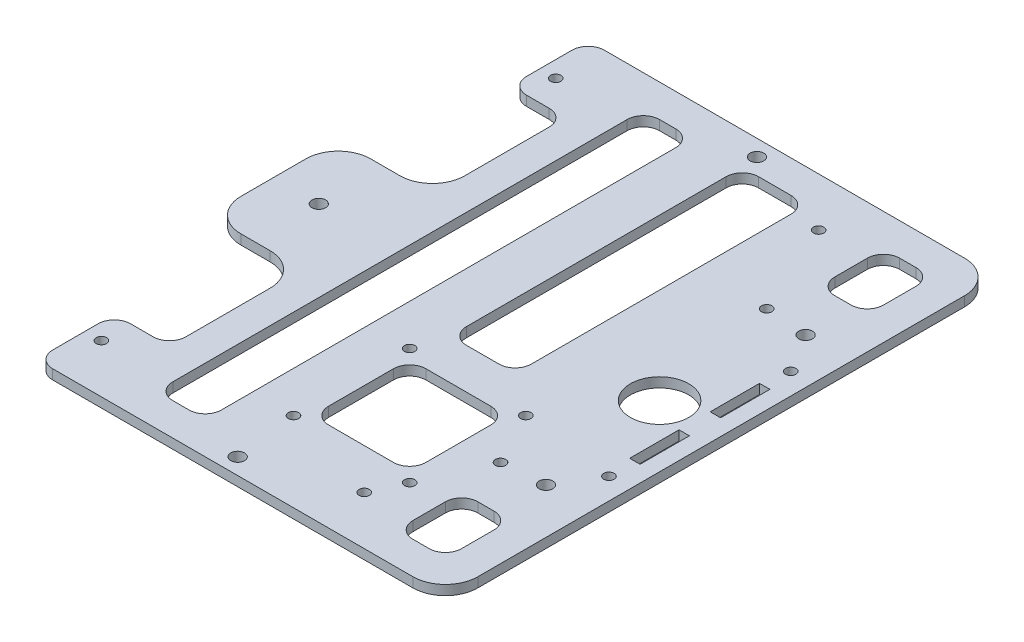
from build123d import *

# Parameters (mm, degrees)
SKETCH1_W           = 138
SKETCH1_H           = 170
BOSS_EXTRUDE1_DEPTH = 3
SKETCH2_R           = 2.1
SKETCH2_W           = 29
SKETCH2_H           = 30
CUT_EXTRUDE1_DEPTH  = 3
SKETCH3_R           = 2.1
CUT_EXTRUDE2_DEPTH  = 219.981734398
SKETCH5_W           = 29
SKETCH5_H           = 35
CUT_EXTRUDE3_DEPTH  = 219.981734398
SKETCH6_R           = 1.6
SKETCH6_W           = 3.2
SKETCH6_H           = 15.2
CUT_EXTRUDE4_DEPTH  = 219.981734398
SKETCH9_W           = 29
SKETCH9_H           = 30
BOSS_EXTRUDE2_DEPTH = 3
SKETCH10_R          = 1.6
CUT_EXTRUDE5_DEPTH  = 219.981734398
FILLET1_R           = 10
FILLET2_R           = 10
SKETCH12_W          = 15
SKETCH12_H          = 150
CUT_EXTRUDE6_DEPTH  = 219.981734398
FILLET3_R           = 5
SKETCH13_R          = 9
SKETCH13_W          = 15
SKETCH13_H          = 20
CUT_EXTRUDE7_DEPTH  = 219.981734398
FILLET4_R           = 5
SKETCH14_W          = 27
SKETCH14_H          = 24
SKETCH14_R          = 1.6
BOSS_EXTRUDE3_DEPTH = 3
SKETCH15_R          = 1.6
CUT_EXTRUDE8_DEPTH  = 219.981734398
FILLET5_R           = 5
SKETCH16_W          = 20
SKETCH16_H          = 90
CUT_EXTRUDE9_DEPTH  = 219.981734398
FILLET6_R           = 5


with BuildPart() as part:
    # Sketch1 → Boss-Extrude1 (new body)
    with BuildSketch(Plane(origin=(0, 0, 0), x_dir=(1, 0, 0), z_dir=(0, 1, 0))):
        with Locations((69, 85)):
            Rectangle(SKETCH1_W, SKETCH1_H)
    extrude(amount=BOSS_EXTRUDE1_DEPTH)

    # Sketch2 → Cut-Extrude1 (cut)
    with BuildSketch(Plane(origin=(0, 3, 0), x_dir=(1, 0, 0), z_dir=(0, 1, 0))):
        with Locations(Location((69, 165, 0), (0, 0, 270))):
            Circle(SKETCH2_R)
        with Locations(Location((69, 5, 0), (0, 0, 270))):
            Circle(SKETCH2_R)
        with Locations((14.5, 155)):
            Rectangle(SKETCH2_W, SKETCH2_H)
        with Locations((123.5, 155)):
            Rectangle(SKETCH2_W, SKETCH2_H)
        with Locations((123.5, 15)):
            Rectangle(SKETCH2_W, SKETCH2_H)
        with Locations((14.5, 15)):
            Rectangle(SKETCH2_W, SKETCH2_H)
    extrude(amount=-CUT_EXTRUDE1_DEPTH, mode=Mode.SUBTRACT)

    # Sketch3 → Cut-Extrude2 (cut, through all)
    with BuildSketch(Plane(origin=(0, 3, 0), x_dir=(1, 0, 0), z_dir=(0, 1, 0))):
        with Locations(Location((14, 125, 0), (0, 0, 270))):
            Circle(SKETCH3_R)
        with Locations(Location((14, 45, 0), (0, 0, 270))):
            Circle(SKETCH3_R)
        with Locations(Location((14, 85, 0), (0, 0, 270))):
            Circle(SKETCH3_R)
        with Locations(Location((124, 45, 0), (0, 0, 90))):
            Circle(SKETCH3_R)
        with Locations(Location((124, 125, 0), (0, 0, 90))):
            Circle(SKETCH3_R)
    extrude(amount=-CUT_EXTRUDE2_DEPTH, mode=Mode.SUBTRACT)

    # Sketch5 → Cut-Extrude3 (cut, through all)
    with BuildSketch(Plane(origin=(0, 3, 0), x_dir=(1, 0, 0), z_dir=(0, 1, 0))):
        with Locations((14.5, 122.5)):
            Rectangle(SKETCH5_W, SKETCH5_H)
        with Locations((14.5, 47.5)):
            Rectangle(SKETCH5_W, SKETCH5_H)
    extrude(amount=-CUT_EXTRUDE3_DEPTH, mode=Mode.SUBTRACT)

    # Sketch6 → Cut-Extrude4 (cut, through all)
    with BuildSketch(Plane(origin=(0, 3, 0), x_dir=(1, 0, 0), z_dir=(0, 1, 0))):
        with Locations(Location((131.4, 113, 0), (0, 0, 270))):
            Circle(SKETCH6_R)
        with Locations(Location((131.4, 57, 0), (0, 0, 270))):
            Circle(SKETCH6_R)
        with Locations((131.4, 97.4)):
            Rectangle(SKETCH6_W, SKETCH6_H)
        with Locations((131.4, 72.6)):
            Rectangle(SKETCH6_W, SKETCH6_H)
    extrude(amount=-CUT_EXTRUDE4_DEPTH, mode=Mode.SUBTRACT)

    # Sketch9 → Boss-Extrude2 (add)
    with BuildSketch(Plane(origin=(0, 3, 0), x_dir=(1, 0, 0), z_dir=(0, 1, 0))):
        with Locations((123.5, 155)):
            Rectangle(SKETCH9_W, SKETCH9_H)
        with Locations((123.5, 15)):
            Rectangle(SKETCH9_W, SKETCH9_H)
    extrude(amount=-BOSS_EXTRUDE2_DEPTH)

    # Sketch10 → Cut-Extrude5 (cut, through all)
    with BuildSketch(Plane(origin=(0, 3, 0), x_dir=(1, 0, 0), z_dir=(0, 1, 0))):
        with Locations(Location((66.6, 60.4, 0), (0, 0, 270))):
            Circle(SKETCH10_R)
        with Locations(Location((102.4, 60.4, 0), (0, 0, 270))):
            Circle(SKETCH10_R)
        with Locations(Location((66.6, 24.6, 0), (0, 0, 270))):
            Circle(SKETCH10_R)
        with Locations(Location((102.4, 24.6, 0), (0, 0, 270))):
            Circle(SKETCH10_R)
        with BuildLine():
            Line((74.5, 57.5), (94.5, 57.5))
            ThreePointArc((94.5, 57.5), (98.035533906, 56.035533906), (99.5, 52.5))
            Line((99.5, 52.5), (99.5, 32.5))
            ThreePointArc((99.5, 32.5), (98.035533906, 28.964466094), (94.5, 27.5))
            Line((94.5, 27.5), (74.5, 27.5))
            ThreePointArc((74.5, 27.5), (70.964466094, 28.964466094), (69.5, 32.5))
            Line((69.5, 32.5), (69.5, 52.5))
            ThreePointArc((69.5, 52.5), (70.964466094, 56.035533906), (74.5, 57.5))
        make_face()
    extrude(amount=-CUT_EXTRUDE5_DEPTH, mode=Mode.SUBTRACT)

    # Fillet1
    fillet1_edges = [part.edges().sort_by_distance(p)[0] for p in [
        (0, 1.5, -105),
        (0, 1.5, -65),
        (138, 1.5, -170),
        (138, 1.5, 0),
        (29, 1.5, 0),
        (29, 1.5, -170),
    ]]
    fillet(fillet1_edges, radius=FILLET1_R)

    # Fillet2
    fillet2_edges = [part.edges().sort_by_distance(p)[0] for p in [
        (29, 1.5, -105),
        (29, 1.5, -65),
    ]]
    fillet(fillet2_edges, radius=FILLET2_R)

    # Sketch12 → Cut-Extrude6 (cut, through all)
    with BuildSketch(Plane(origin=(0, 3, 0), x_dir=(1, 0, 0), z_dir=(0, 1, 0))):
        with Locations((46.5, 85)):
            Rectangle(SKETCH12_W, SKETCH12_H)
    extrude(amount=-CUT_EXTRUDE6_DEPTH, mode=Mode.SUBTRACT)

    # Fillet3
    fillet3_edges = [part.edges().sort_by_distance(p)[0] for p in [
        (39, 1.5, -10),
        (39, 1.5, -160),
        (54, 1.5, -160),
        (54, 1.5, -10),
    ]]
    fillet(fillet3_edges, radius=FILLET3_R)

    # Sketch13 → Cut-Extrude7 (cut, through all)
    with BuildSketch(Plane(origin=(0, 3, 0), x_dir=(1, 0, 0), z_dir=(0, 1, 0))):
        with Locations(Location((119, 85, 0), (0, 0, 270))):
            Circle(SKETCH13_R)
        with Locations((120.5, 150)):
            Rectangle(SKETCH13_W, SKETCH13_H)
        with Locations((120.5, 20)):
            Rectangle(SKETCH13_W, SKETCH13_H)
    extrude(amount=-CUT_EXTRUDE7_DEPTH, mode=Mode.SUBTRACT)

    # Fillet4
    fillet4_edges = [part.edges().sort_by_distance(p)[0] for p in [
        (113, 1.5, -140),
        (113, 1.5, -160),
        (128, 1.5, -160),
        (128, 1.5, -140),
        (113, 1.5, -10),
        (113, 1.5, -30),
        (128, 1.5, -30),
        (128, 1.5, -10),
    ]]
    fillet(fillet4_edges, radius=FILLET4_R)

    # Sketch14 → Boss-Extrude3 (add)
    # profile 1 of 2: a face of its own
    with BuildSketch(Plane(origin=(0, 3, 0), x_dir=(1, 0, 0), z_dir=(0, 1, 0))):
        with Locations((25.5, 158)):
            Rectangle(SKETCH14_W, SKETCH14_H)
        with Locations(Location((17, 155, 0), (0, 0, 270))):
            Circle(SKETCH14_R, mode=Mode.SUBTRACT)
    # profile 2 of 2: a face of its own
    with BuildSketch(Plane(origin=(0, 3, 0), x_dir=(1, 0, 0), z_dir=(0, 1, 0))):
        with Locations((25.5, 12)):
            Rectangle(SKETCH14_W, SKETCH14_H)
        with Locations(Location((17, 15, 0), (0, 0, 270))):
            Circle(SKETCH14_R, mode=Mode.SUBTRACT)
    extrude(amount=-BOSS_EXTRUDE3_DEPTH)

    # Sketch15 → Cut-Extrude8 (cut, through all)
    with BuildSketch(Plane(origin=(0, 3, 0), x_dir=(1, 0, 0), z_dir=(0, 1, 0))):
        with Locations(Location((111, 44, 0), (0, 0, 270))):
            Circle(SKETCH15_R)
        with Locations(Location((111, 126, 0), (0, 0, 270))):
            Circle(SKETCH15_R)
        with Locations(Location((98, 155, 0), (0, 0, 270))):
            Circle(SKETCH15_R)
        with Locations(Location((98, 15, 0), (0, 0, 270))):
            Circle(SKETCH15_R)
    extrude(amount=-CUT_EXTRUDE8_DEPTH, mode=Mode.SUBTRACT)

    # Fillet5
    fillet5_edges = [part.edges().sort_by_distance(p)[0] for p in [
        (29, 1.5, -146),
        (12, 1.5, -146),
        (12, 1.5, -170),
        (12, 1.5, -24),
        (12, 1.5, 0),
        (29, 1.5, -24),
    ]]
    fillet(fillet5_edges, radius=FILLET5_R)

    # Sketch16 → Cut-Extrude9 (cut, through all)
    with BuildSketch(Plane(origin=(0, 3, 0), x_dir=(1, 0, 0), z_dir=(0, 1, 0))):
        with Locations((79.5, 115)):
            Rectangle(SKETCH16_W, SKETCH16_H)
    extrude(amount=-CUT_EXTRUDE9_DEPTH, mode=Mode.SUBTRACT)

    # Fillet6
    fillet6_edges = [part.edges().sort_by_distance(p)[0] for p in [
        (69.5, 1.5, -70),
        (69.5, 1.5, -160),
        (89.5, 1.5, -160),
        (89.5, 1.5, -70),
    ]]
    fillet(fillet6_edges, radius=FILLET6_R)


solid = part.part
